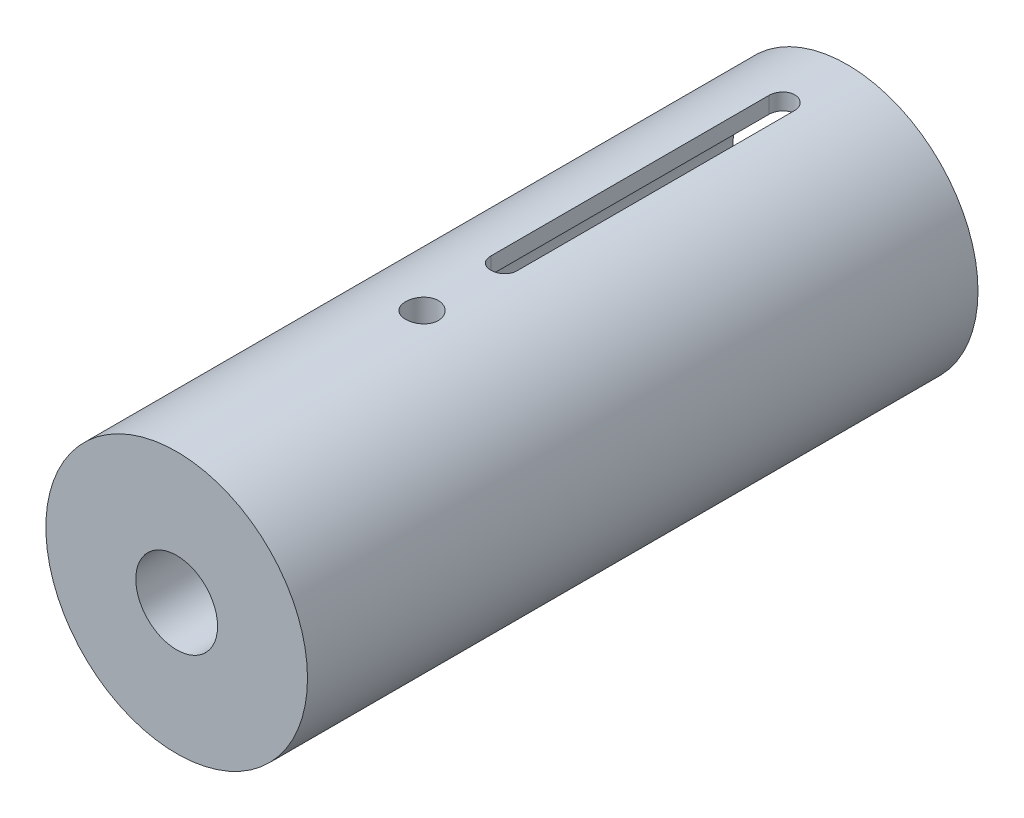
from build123d import *

# Parameters (mm, degrees)
SKETCH1_R               = 8
SKETCH1_R_2             = 7
BOSS_EXTRUDE1_DEPTH     = 41
CUT_EXTRUDE1_DEPTH      = 43.532340636
CUT_EXTRUDE1_DEPTH_BACK = 43.532340636
BOSS_EXTRUDE2_START     = -17
SKETCH3_R               = 7
SKETCH3_R_2             = 2.5
BOSS_EXTRUDE2_DEPTH     = 17
SKETCH4_R               = 1
CUT_EXTRUDE2_DEPTH      = 17


with BuildPart() as part:
    # Sketch1 → Boss-Extrude1 (new body)
    with BuildSketch(Plane.XY):
        Circle(SKETCH1_R)
        Circle(SKETCH1_R_2, mode=Mode.SUBTRACT)
    extrude(amount=BOSS_EXTRUDE1_DEPTH)

    # Sketch2 → Cut-Extrude1 (cut, two sides: drawn at the far end of the back side and taken through both)
    with BuildSketch(Plane(origin=(0, 0, 0), x_dir=(1, 0, 0), z_dir=(0, 1, 0)).offset(-CUT_EXTRUDE1_DEPTH_BACK)):
        with BuildLine():
            Line((-0.79375, -4), (-0.79375, -21))
            ThreePointArc((-0.79375, -21), (0, -21.79375), (0.79375, -21))
            Line((0.79375, -21), (0.79375, -4))
            ThreePointArc((0.79375, -4), (0, -3.20625), (-0.79375, -4))
        make_face()
    extrude(amount=CUT_EXTRUDE1_DEPTH + CUT_EXTRUDE1_DEPTH_BACK, mode=Mode.SUBTRACT)

    # Sketch3 → Boss-Extrude2 (add)
    with BuildSketch(Plane.XY.offset(41).offset(BOSS_EXTRUDE2_START)):
        Circle(SKETCH3_R)
        Circle(SKETCH3_R_2, mode=Mode.SUBTRACT)
    extrude(amount=BOSS_EXTRUDE2_DEPTH)

    # Sketch4 → Cut-Extrude2 (cut)
    with BuildSketch(Plane(origin=(0, 0, 0), x_dir=(1, 0, 0), z_dir=(0, 1, 0))):
        with Locations(Location((0, -26, 0), (0, 0, 90))):
            Circle(SKETCH4_R)
    extrude(amount=CUT_EXTRUDE2_DEPTH, mode=Mode.SUBTRACT)


solid = part.part
